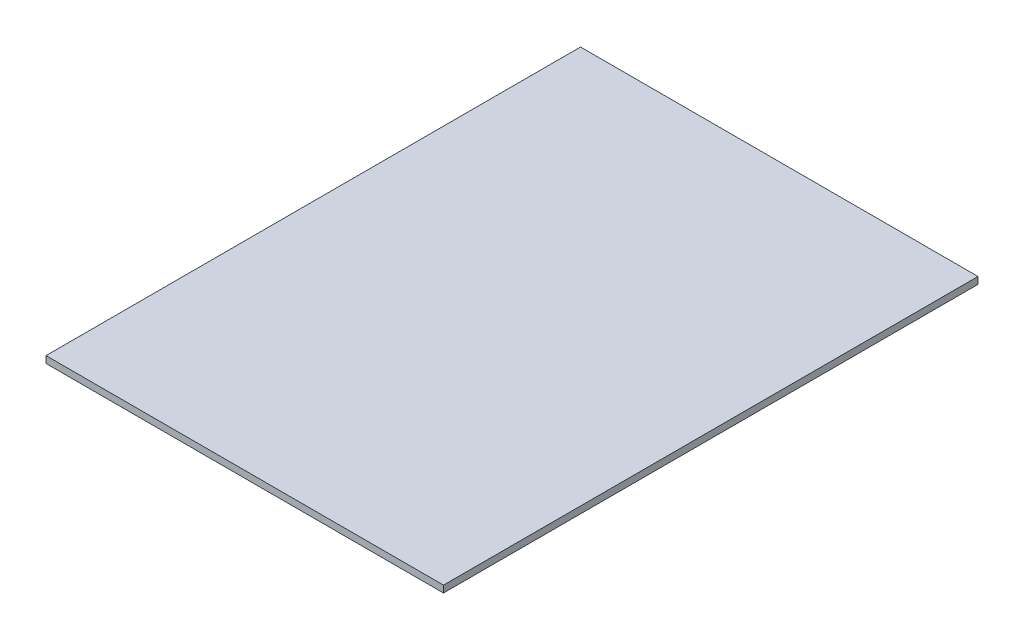
from build123d import *

# Parameters (mm, degrees)
SKETCH2_W           = 145
SKETCH2_H           = 195
BOSS_EXTRUDE1_DEPTH = 1.25


with BuildPart() as part:
    # Sketch2 → Boss-Extrude1 (new, symmetric)
    with BuildSketch(Plane(origin=(0, 0, 0), x_dir=(1, 0, 0), z_dir=(0, 1, 0))):
        Rectangle(SKETCH2_W, SKETCH2_H)
    extrude(amount=BOSS_EXTRUDE1_DEPTH, both=True)


solid = part.part
